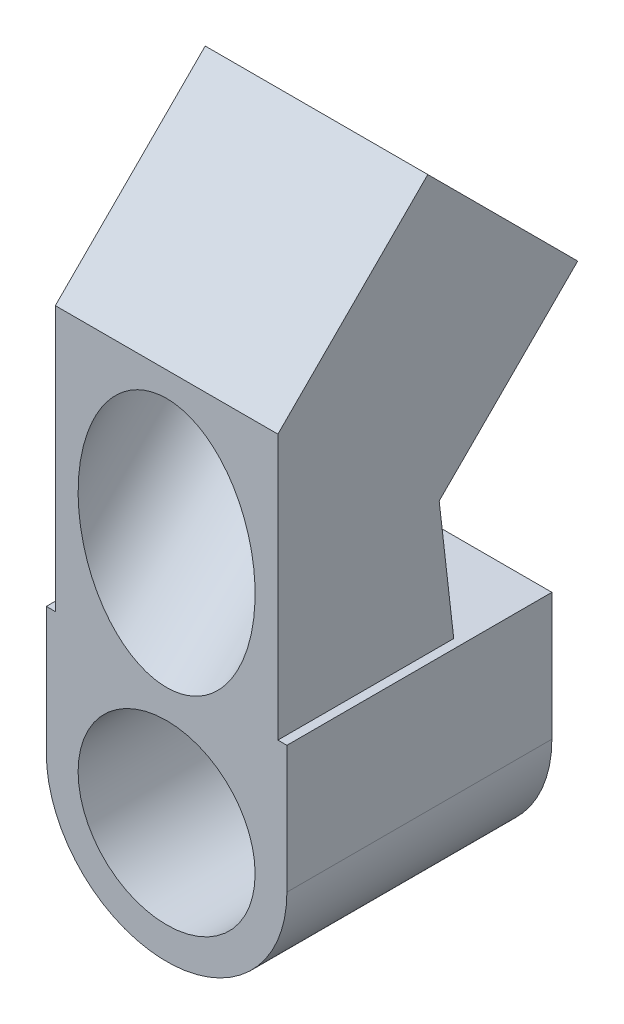
from build123d import *

# Parameters (mm, degrees)
CROQUIS1_R              = 8.35
SALIENTE_EXTRUIR1_DEPTH = 12.5
SALIENTE_EXTRUIR2_DEPTH = 10.5
CROQUIS3_R              = 8.35
CORTAR_EXTRUIR1_DEPTH   = 47


with BuildPart() as part:
    # Croquis1 → Saliente-Extruir1 (new, symmetric)
    with BuildSketch(Plane.XY):
        with BuildLine():
            Line((-11.35, 12), (11.35, 12))
            Line((11.35, 12), (11.35, 0))
            ThreePointArc((11.35, 0), (0, -11.35), (-11.35, 0))
            Line((-11.35, 0), (-11.35, 12))
        make_face()
        Circle(CROQUIS1_R, mode=Mode.SUBTRACT)
    extrude(amount=SALIENTE_EXTRUIR1_DEPTH, both=True)

    # Croquis2 → Saliente-Extruir2 (add, symmetric)
    with BuildSketch(Plane(origin=(0, 0, 0), x_dir=(0, 0, -1), z_dir=(1, 0, 0))):
        Polygon((-12.5, 12), (-12.5, 37), (1.642135624, 51.142135624), (15.784271247, 37), (2.716681877, 23.93241063), (4.090100333, 12), align=None)
    extrude(amount=SALIENTE_EXTRUIR2_DEPTH, both=True)

    # Croquis3 → Cortar-Extruir1 (cut)
    with BuildSketch(Plane(origin=(0, 26.392135624, -26.392135624), x_dir=(1, 0, 0), z_dir=(0, 0.7071067811865465, -0.7071067811865487))):
        with Locations(Location((0, -25.001785669, 0), (0, 0, 270))):
            Circle(CROQUIS3_R)
    extrude(amount=-CORTAR_EXTRUIR1_DEPTH, mode=Mode.SUBTRACT)


solid = part.part
